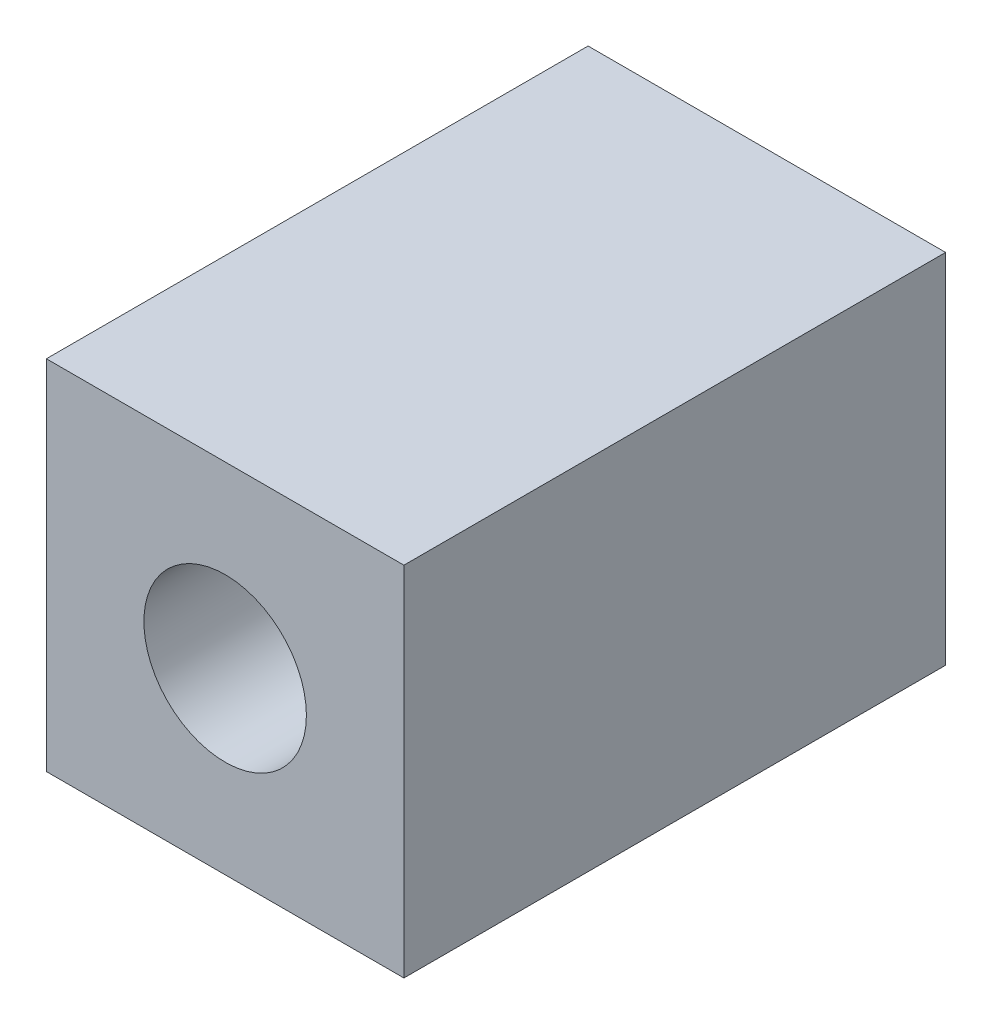
from build123d import *

# Parameters (mm, degrees)
CROQUIS1_W              = 6.6
CROQUIS1_H              = 6.6
SALIENTE_EXTRUIR1_DEPTH = 10
CROQUIS2_R              = 1.5
CORTAR_EXTRUIR1_DEPTH   = 4
CROQUIS3_W              = 3.2
CROQUIS3_H              = 3.2
CORTAR_EXTRUIR2_DEPTH   = 4


with BuildPart() as part:
    # Croquis1 → Saliente-Extruir1 (new body)
    with BuildSketch(Plane.XY):
        with Locations((-17.592123702, 1.080530973)):
            Rectangle(CROQUIS1_W, CROQUIS1_H)
    extrude(amount=SALIENTE_EXTRUIR1_DEPTH)

    # Croquis2 → Cortar-Extruir1 (cut)
    with BuildSketch(Plane.XY.offset(10)):
        with Locations((-17.592123702, 1.080530973)):
            Circle(CROQUIS2_R)
    extrude(amount=-CORTAR_EXTRUIR1_DEPTH, mode=Mode.SUBTRACT)

    # Croquis3 → Cortar-Extruir2 (cut)
    with BuildSketch(Plane(origin=(0, 0, 0), x_dir=(-1, 0, 0), z_dir=(0, 0, -1))):
        with Locations((17.592123702, 1.080530973)):
            Rectangle(CROQUIS3_W, CROQUIS3_H)
    extrude(amount=-CORTAR_EXTRUIR2_DEPTH, mode=Mode.SUBTRACT)


solid = part.part
